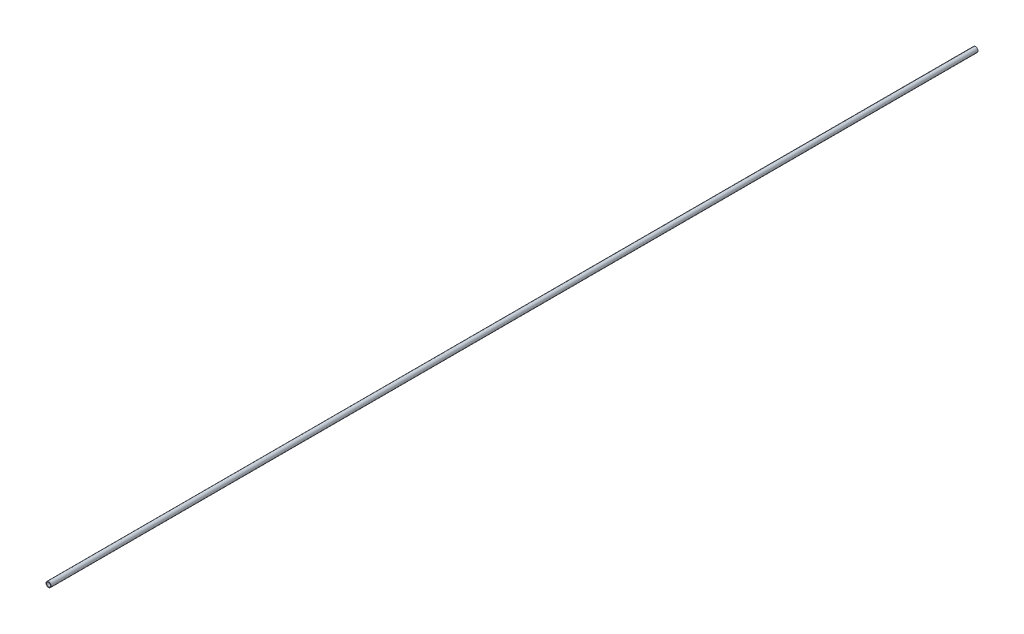
from build123d import *

# Parameters (mm, degrees)
SKETCH1_R      = 16.7005
SKETCH1_R_2    = 13.3223
BASEPIPE_DEPTH = 3048


with BuildPart() as part:
    # Sketch1 → BasePipe (new, symmetric)
    with BuildSketch(Plane.XY):
        Circle(SKETCH1_R)
        Circle(SKETCH1_R_2, mode=Mode.SUBTRACT)
    extrude(amount=BASEPIPE_DEPTH, both=True)


solid = part.part
